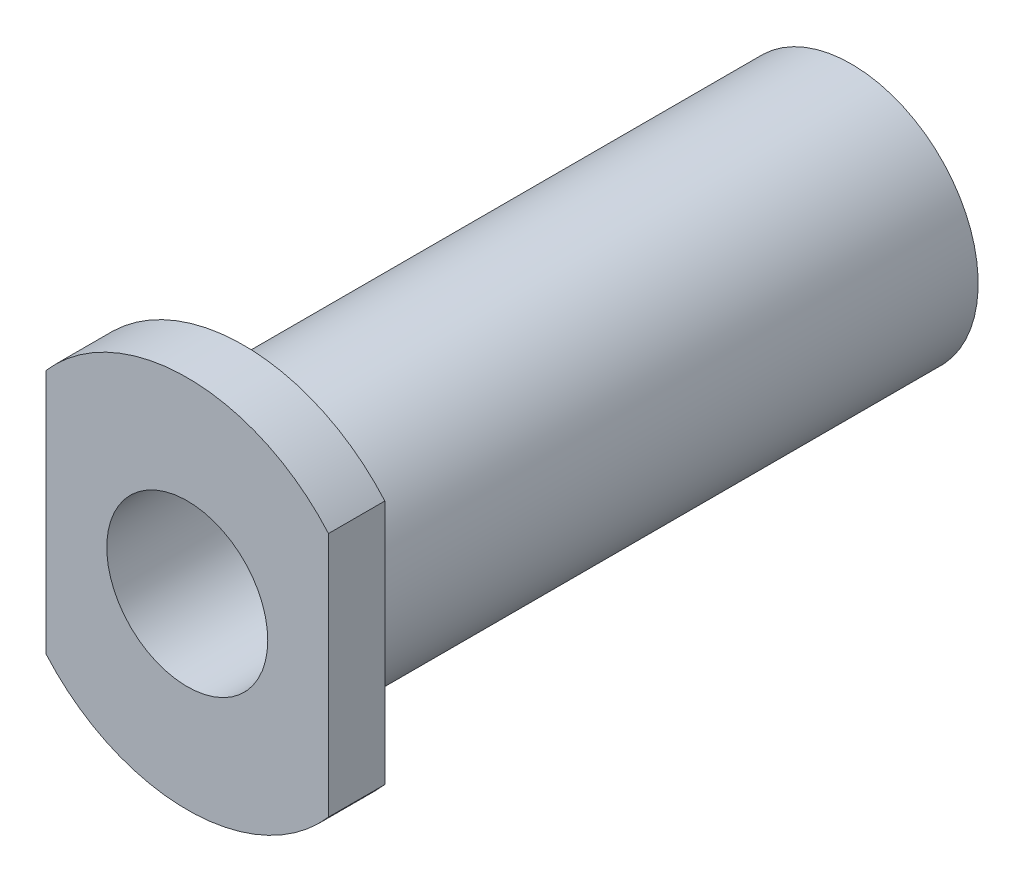
from build123d import *

# Parameters (mm, degrees)
EXTRUDE_1_DEPTH     = 14
SKETCH_2_R          = 31.5
EXTRUDE_2_DEPTH     = 151
CUT_EXTRUDE_1_DEPTH = 175.982394882


with BuildPart() as part:
    # 草图1 → 凸台-拉伸1 (new body)
    with BuildSketch(Plane.XY):
        with BuildLine():
            ThreePointArc((35.09399548, 30.506744848), (0, 46.5), (-35.09399548, 30.506744848))
            Line((-35.09399548, 30.506744848), (-35.09399548, -30.506744848))
            ThreePointArc((-35.09399548, -30.506744848), (0, -46.5), (35.09399548, -30.506744848))
            Line((35.09399548, -30.506744848), (35.09399548, 9.403407748))
            Line((35.09399548, 9.403407748), (35.09399548, 30.506744848))
        make_face()
        with BuildLine():
            ThreePointArc((20, 0), (-19.828897227, -2.610523844), (19.318516526, 5.176380902))
            ThreePointArc((19.318516526, 5.176380902), (19.828897227, 2.610523844), (20, 0))
        make_face(mode=Mode.SUBTRACT)
    extrude(amount=-EXTRUDE_1_DEPTH)

    # 草图2 → 凸台-拉伸2 (add)
    with BuildSketch(Plane(origin=(0, 0, -14), x_dir=(-1, 0, 0), z_dir=(0, 0, -1))):
        Circle(SKETCH_2_R)
    extrude(amount=EXTRUDE_2_DEPTH)

    # 草图1<3> → 切除-拉伸1 (cut, through all)
    with BuildSketch(Plane.XY):
        with BuildLine():
            ThreePointArc((20, 0), (19.828897227, 2.610523844), (19.318516526, 5.176380902))
            ThreePointArc((19.318516526, 5.176380902), (-19.828897227, -2.610523844), (20, 0))
        make_face()
    extrude(amount=-CUT_EXTRUDE_1_DEPTH, mode=Mode.SUBTRACT)


solid = part.part
